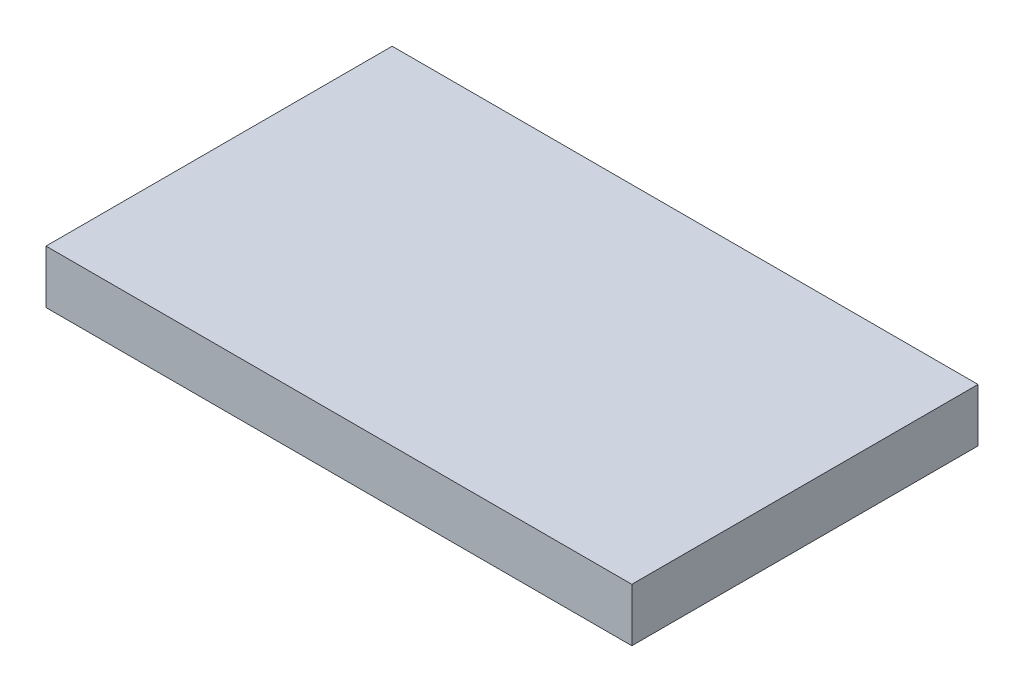
from build123d import *

# Parameters (mm, degrees)
SKETCH1_W           = 22
SKETCH1_H           = 13
BOSS_EXTRUDE1_DEPTH = 1


with BuildPart() as part:
    # Sketch1 → Boss-Extrude1 (new, symmetric)
    with BuildSketch(Plane(origin=(0, 0, 0), x_dir=(1, 0, 0), z_dir=(0, 1, 0))):
        Rectangle(SKETCH1_W, SKETCH1_H)
    extrude(amount=BOSS_EXTRUDE1_DEPTH, both=True)


solid = part.part
